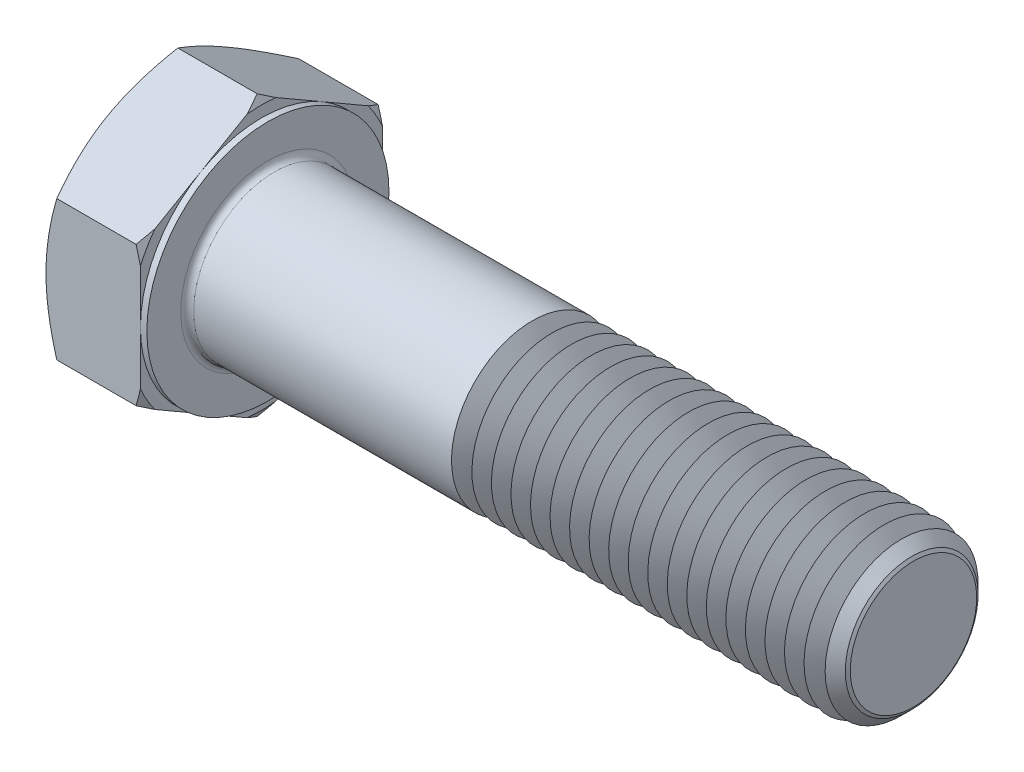
from build123d import *

# Parameters (mm, degrees)
EXTRUDE_373_DEPTH      = 12.5
SKETCH_4_W             = 0.8
SKETCH_4_H             = 12.320508076
CHAMFER_2074_SIZE      = 2
FILLET_2116_R          = 0.8
PATTERN_LINEAR_1_COUNT = 20
PATTERN_LINEAR_1_PITCH = 2.421052632


with BuildPart() as part:
    # 草图1 → Extrude 373 (new body)
    with BuildSketch(Plane(origin=(0, 0, 0), x_dir=(0, 0, -1), z_dir=(1, 0, 0))):
        Polygon((15, 8.660254038), (15, -8.660254038), (0, -17.320508076), (-15, -8.660254038), (-15, 8.660254038), (0, 17.320508076), align=None)
    extrude(amount=EXTRUDE_373_DEPTH)

    # 草图2 → 凸台-旋转1 (revolve)
    with BuildSketch(Plane.XY, mode=Mode.PRIVATE) as revolve_1_sk:
        Polygon((0, 0), (92.5, 0), (92.5, 7.835), (92.5, 10), (27.8072, 10), (0, 10), align=None)
    revolve(revolve_1_sk.sketch.rotate(Axis((0, 0, 0), (1, 0, 0)), 90), axis=Axis((0, 0, 0), (1, 0, 0)))

    # 草图3 → 切除-旋转1 (revolve, cut)
    with BuildSketch(Plane.XY):
        Polygon((0, 15), (4.226497308, 22.320508076), (4.226497308, 27.320508076), (-10, 27.320508076), (-10, 15), align=None)
    revolve(axis=Axis((0, 0, 0), (1, 0, 0)), mode=Mode.SUBTRACT)

    # 草图5 → 切除-旋转2 (revolve, cut)
    with BuildSketch(Plane.XY):
        Polygon((12.5, 15), (8.273502692, 22.320508076), (8.273502692, 27.320508076), (18.273502692, 27.320508076), (18.273502692, 15), align=None)
    revolve(axis=Axis((0, 0, 0), (1, 0, 0)), mode=Mode.SUBTRACT)

    # 草图4 → 切除-旋转3 (revolve, cut)
    with BuildSketch(Plane.XY, mode=Mode.PRIVATE) as cut_revolve_3_sk:
        with Locations((12.1, 21.160254038)):
            Rectangle(SKETCH_4_W, SKETCH_4_H)
    revolve(cut_revolve_3_sk.sketch.rotate(Axis((0, 0, 0), (1, 0, 0)), 270), axis=Axis((0, 0, 0), (1, 0, 0)), mode=Mode.SUBTRACT)

    # Chamfer 2074
    chamfer_2074_edges = [part.edges().sort_by_distance(p)[0] for p in [
        (92.5, 0, -10),
    ]]
    chamfer(chamfer_2074_edges, length=CHAMFER_2074_SIZE)

    # Fillet 2116
    fillet_2116_edges = [part.edges().sort_by_distance(p)[0] for p in [
        (12.5, 0, -10),
    ]]
    fillet(fillet_2116_edges, radius=FILLET_2116_R)

    # 草图6 → 切除-旋转4 (revolve, cut)
    with BuildSketch(Plane.XY):
        Polygon((46.5, -7.835), (45.250036667, -10), (45.250036667, -12.5), (47.749963333, -12.5), (47.749963333, -10), align=None)
    cut_revolve_4 = revolve(axis=Axis((-3.175, 0, 0), (1, 0, 0)), mode=Mode.SUBTRACT)

    # 阵列(线性)1: 切除-旋转4 ×20
    with Locations(*[(i * PATTERN_LINEAR_1_PITCH, 0, 0) for i in range(1, PATTERN_LINEAR_1_COUNT)]):
        add(cut_revolve_4, mode=Mode.SUBTRACT)


solid = part.part
